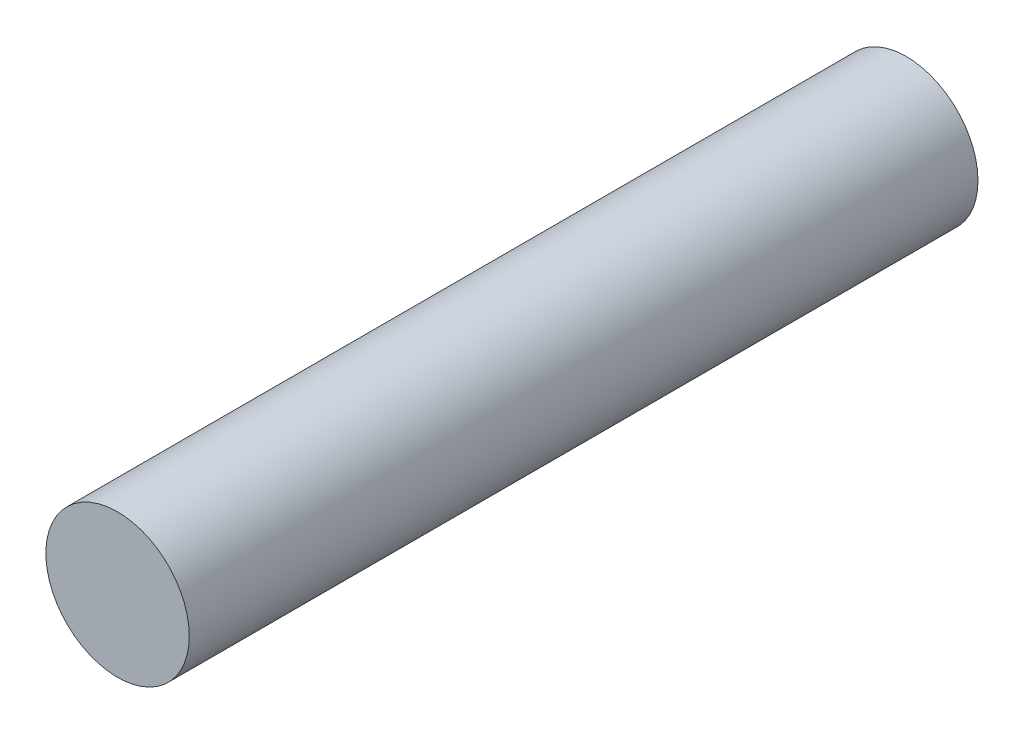
from build123d import *

# Parameters (mm, degrees)
SKETCH_1_R      = 5
EXTRUDE_1_DEPTH = 55


with BuildPart() as part:
    # 草图1 → 凸台-拉伸1 (new body)
    with BuildSketch(Plane.XY):
        with Locations((-14.575874441, 3.258833716)):
            Circle(SKETCH_1_R)
    extrude(amount=EXTRUDE_1_DEPTH)


solid = part.part
